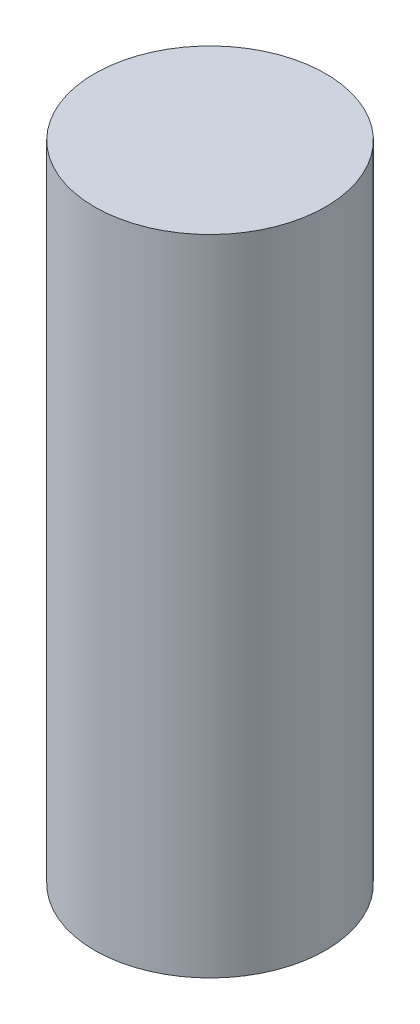
from build123d import *

# Parameters (mm, degrees)
SKETCH1_R           = 31.125
BOSS_EXTRUDE1_DEPTH = 173.5


with BuildPart() as part:
    # Sketch1 → Boss-Extrude1 (new body)
    with BuildSketch(Plane(origin=(0, 0, 0), x_dir=(1, 0, 0), z_dir=(0, 1, 0))):
        with Locations(Location((0, 0, 0), (0, 0, 270))):
            Circle(SKETCH1_R)
    extrude(amount=BOSS_EXTRUDE1_DEPTH)


solid = part.part
